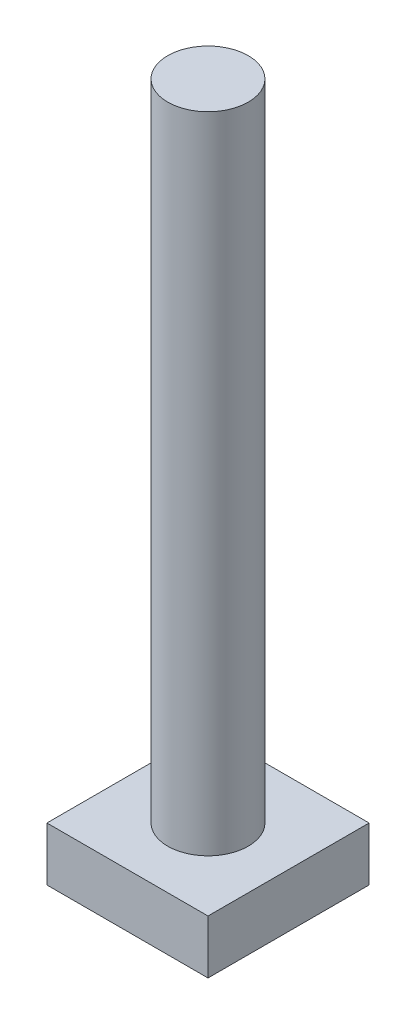
from build123d import *

# Parameters (mm, degrees)
SKETCH1_W           = 24
SKETCH1_H           = 24
BOSS_EXTRUDE1_DEPTH = 4
SKETCH2_R           = 6
BOSS_EXTRUDE2_DEPTH = 96


with BuildPart() as part:
    # Sketch1 → Boss-Extrude1 (new, symmetric)
    with BuildSketch(Plane(origin=(0, 0, 0), x_dir=(1, 0, 0), z_dir=(0, 1, 0))):
        Rectangle(SKETCH1_W, SKETCH1_H)
    extrude(amount=BOSS_EXTRUDE1_DEPTH, both=True)

    # Sketch2 → Boss-Extrude2 (add)
    with BuildSketch(Plane(origin=(0, 4, 0), x_dir=(1, 0, 0), z_dir=(0, 1, 0))):
        with Locations(Location((0, 0, 0), (0, 0, 270))):
            Circle(SKETCH2_R)
    extrude(amount=BOSS_EXTRUDE2_DEPTH)


solid = part.part
